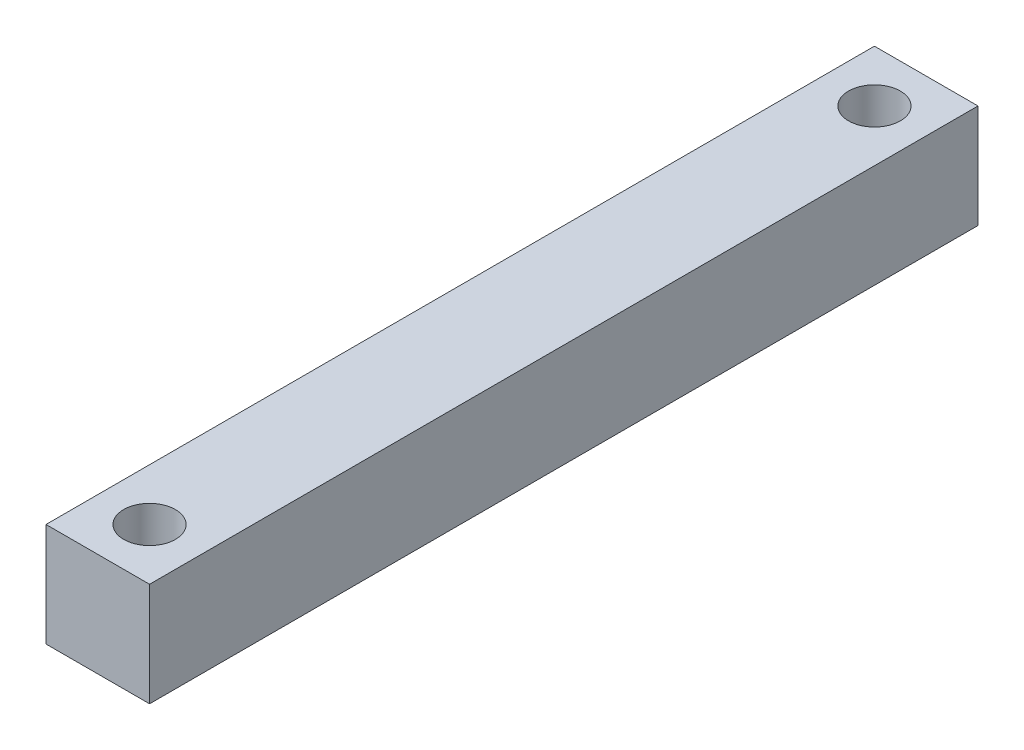
from build123d import *

# Parameters (mm, degrees)
SKETCH1_W               = 10
SKETCH1_H               = 10
BOSS_EXTRUDE1_DEPTH     = 40
CUT_EXTRUDE1_DEPTH      = 41.620192023
CUT_EXTRUDE1_DEPTH_BACK = 41.620192023
SKETCH2_R               = 2.5


with BuildPart() as part:
    # Sketch1 → Boss-Extrude1 (new, symmetric)
    with BuildSketch(Plane.XY):
        Rectangle(SKETCH1_W, SKETCH1_H)
    extrude(amount=BOSS_EXTRUDE1_DEPTH, both=True)

    # Sketch2 → Cut-Extrude1 (cut, two sides: drawn at the far end of the back side and taken through both)
    with BuildSketch(Plane(origin=(0, 0, 0), x_dir=(1, 0, 0), z_dir=(0, 1, 0)).offset(-CUT_EXTRUDE1_DEPTH_BACK)):
        with Locations(Location((0, -35, 0), (0, 0, 270))):
            Circle(SKETCH2_R)
        with Locations(Location((0, 35, 0), (0, 0, 90))):
            Circle(SKETCH2_R)
    extrude(amount=CUT_EXTRUDE1_DEPTH + CUT_EXTRUDE1_DEPTH_BACK, mode=Mode.SUBTRACT)


solid = part.part
